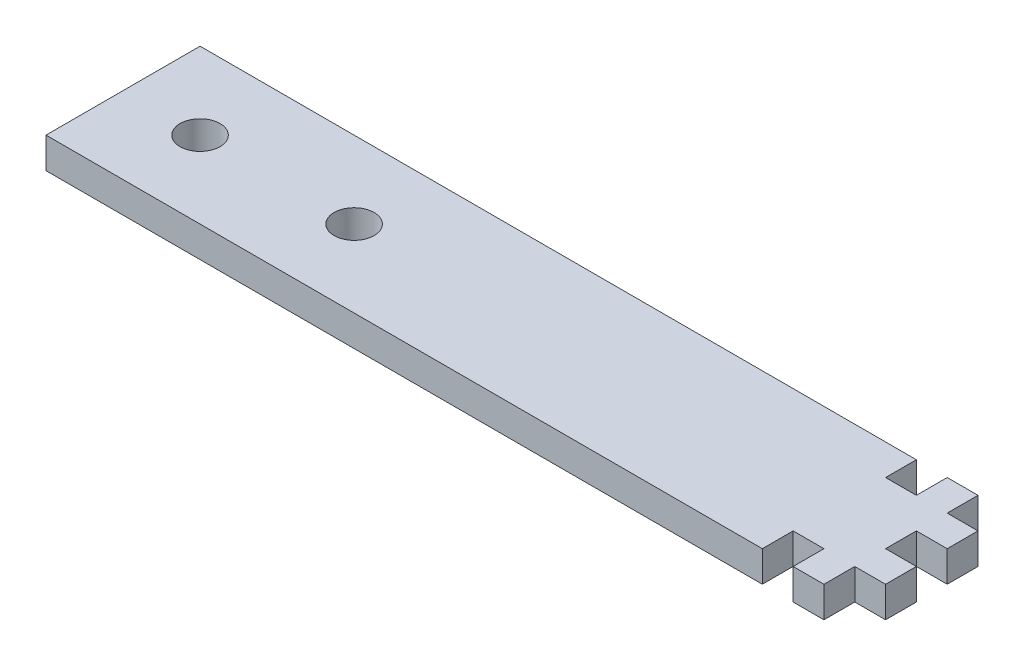
from build123d import *

# Parameters (mm, degrees)
SKETCH1_W               = 66.675
SKETCH1_H               = 12.7
BOSS_EXTRUDE1_DEPTH     = 2.54
CUT_EXTRUDE1_DEPTH      = 1.27
CUT_EXTRUDE1_DEPTH_BACK = 68.921257534
SKETCH3_W               = 2.54
SKETCH3_H               = 2.54
SKETCH4_R               = 1.651
CUT_EXTRUDE2_DEPTH      = 68.921257534
SKETCH5_W               = 2.54
SKETCH5_H               = 2.54
CUT_EXTRUDE3_DEPTH      = 68.921257534


with BuildPart() as part:
    # Sketch1 → Boss-Extrude1 (new body)
    with BuildSketch(Plane(origin=(0, 0, 0), x_dir=(1, 0, 0), z_dir=(0, 1, 0))):
        with Locations((33.3375, 6.35)):
            Rectangle(SKETCH1_W, SKETCH1_H)
    extrude(amount=BOSS_EXTRUDE1_DEPTH)

    # Sketch3 → Cut-Extrude1 (cut, two sides: drawn at the far end of the back side and taken through both)
    with BuildSketch(Plane(origin=(0, 2.54, 0), x_dir=(1, 0, 0), z_dir=(0, 1, 0)).offset(-CUT_EXTRUDE1_DEPTH_BACK)):
        with Locations((65.405, 6.35)):
            Rectangle(SKETCH3_W, SKETCH3_H)
        with Locations((65.405, 11.43)):
            Rectangle(SKETCH3_W, SKETCH3_H)
        with Locations((65.405, 1.27)):
            Rectangle(SKETCH3_W, SKETCH3_H)
    extrude(amount=CUT_EXTRUDE1_DEPTH + CUT_EXTRUDE1_DEPTH_BACK, mode=Mode.SUBTRACT)

    # Sketch4 → Cut-Extrude2 (cut, through all)
    with BuildSketch(Plane(origin=(0, 2.54, 0), x_dir=(1, 0, 0), z_dir=(0, 1, 0))):
        with Locations((6.35, 6.35)):
            Circle(SKETCH4_R)
        with Locations((19.05, 6.35)):
            Circle(SKETCH4_R)
    extrude(amount=-CUT_EXTRUDE2_DEPTH, mode=Mode.SUBTRACT)

    # Sketch5 → Cut-Extrude3 (cut, through all)
    with BuildSketch(Plane(origin=(0, 2.54, 0), x_dir=(1, 0, 0), z_dir=(0, 1, 0))):
        with Locations((60.325, 1.27)):
            Rectangle(SKETCH5_W, SKETCH5_H)
        with Locations((60.325, 11.43)):
            Rectangle(SKETCH5_W, SKETCH5_H)
    extrude(amount=-CUT_EXTRUDE3_DEPTH, mode=Mode.SUBTRACT)


solid = part.part
